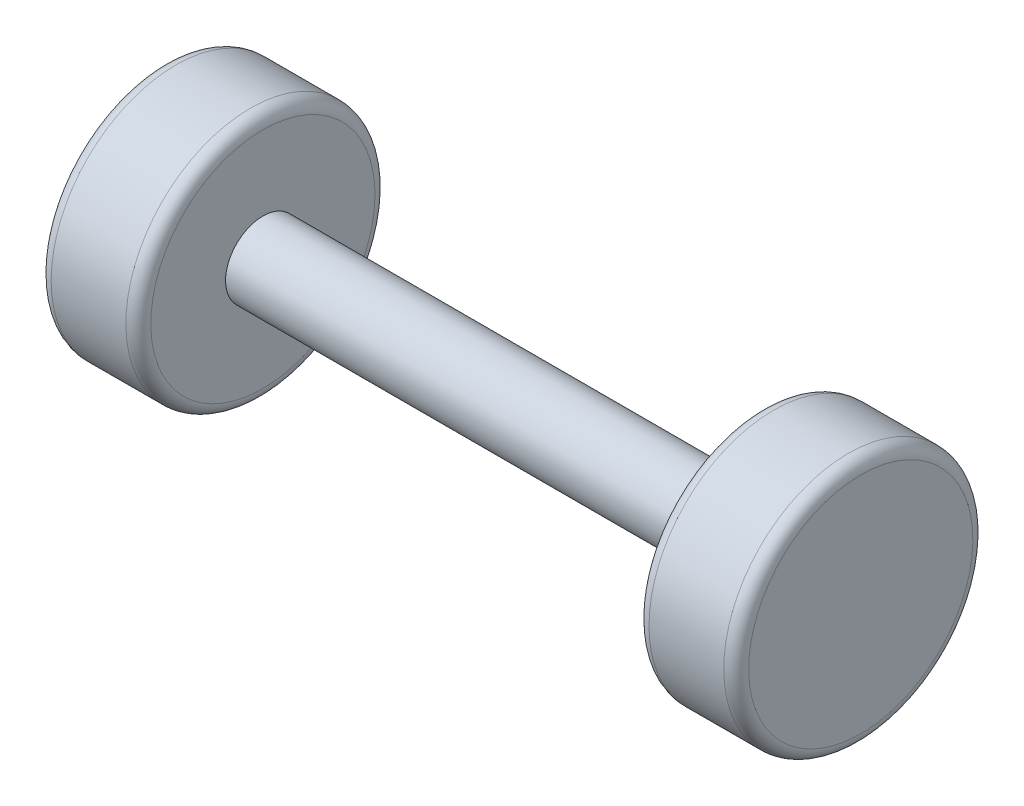
from build123d import *

# Parameters (mm, degrees)
CONG_1_R = 5


with BuildPart() as part:
    # Esquisse1 → Révolution1 (revolve)
    with BuildSketch(Plane.XY):
        Polygon((0, 0), (-140, 0), (-140, 50), (-100, 50), (-100, 15), (0, 15), align=None)
    r_volution1 = revolve(axis=Axis((0, 0, 0), (-1, 0, 0)))

    # Symétrie1: Révolution1 across plane
    add(r_volution1.mirror(Plane(origin=(0, 0, 0), x_dir=(0, 0, 1), z_dir=(1, 0, 0))))

    # Congé1
    cong_1_edges = [part.edges().sort_by_distance(p)[0] for p in [
        (100, -50, 0),
        (140, -50, 0),
        (-140, -50, 0),
        (-100, -50, 0),
    ]]
    fillet(cong_1_edges, radius=CONG_1_R)


solid = part.part
